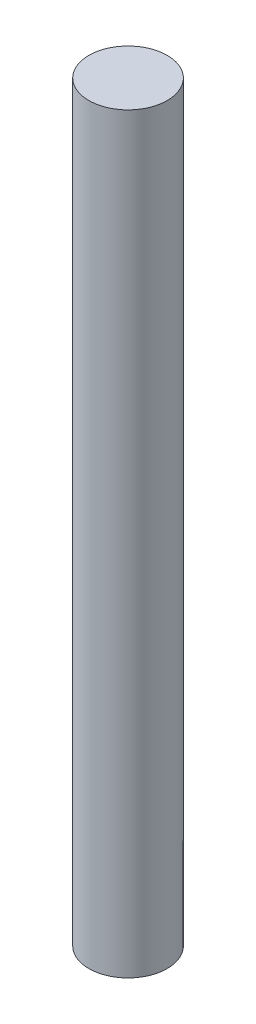
from build123d import *

# Parameters (mm, degrees)
SKETCH1_R                  = 3.96875
BOSS_EXTRUDE1_DEPTH        = 76.2
F_10_32_TAPPED_HOLE1_D     = 4.0386
F_10_32_TAPPED_HOLE1_DEPTH = 12.7
F_10_32_TAPPED_HOLE1_TIP   = 1.213317848


with BuildPart() as part:
    # Sketch1 → Boss-Extrude1 (new body)
    with BuildSketch(Plane(origin=(0, 0, 0), x_dir=(1, 0, 0), z_dir=(0, 1, 0))):
        with Locations(Location((0, 0, 0), (0, 0, 90))):
            Circle(SKETCH1_R)
    extrude(amount=BOSS_EXTRUDE1_DEPTH)

    # #10-32 Tapped Hole1
    with Locations(Plane(origin=(0, 0, 0), x_dir=(-1, 0, 0), z_dir=(0, -1, 0))):
        with Locations((0, 0)):
            Hole(F_10_32_TAPPED_HOLE1_D / 2, depth=F_10_32_TAPPED_HOLE1_DEPTH)
            with Locations((0, 0, -(F_10_32_TAPPED_HOLE1_DEPTH + F_10_32_TAPPED_HOLE1_TIP / 2))):  # 118° drill point
                Cone(0, F_10_32_TAPPED_HOLE1_D / 2, F_10_32_TAPPED_HOLE1_TIP, mode=Mode.SUBTRACT)


solid = part.part
